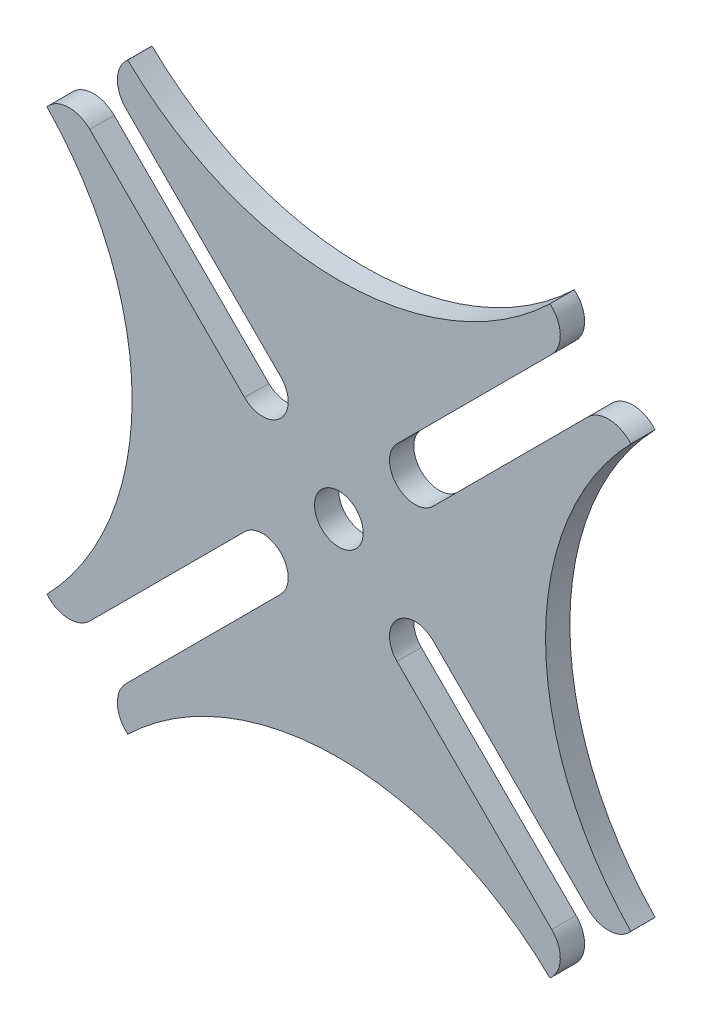
from build123d import *

# Parameters (mm, degrees)
SKICA1_R                = 5
P_IDAT_VYSUNUT_M1_DEPTH = 5


with BuildPart() as part:
    # Skica1 → Přidat vysunutím1 (new body)
    with BuildSketch(Plane.XY):
        with BuildLine():
            Line((11.954171039, 19.378792599), (43.773975828, 51.198598116))
            ThreePointArc((43.773975828, 51.198598116), (45.525986921, 55.694516194), (43.400986545, 60.026628339))
            ThreePointArc((43.400986545, 60.026628339), (5.05e-07, 42.500001775), (-43.400985944, 60.026627326))
            ThreePointArc((-43.400985944, 60.026627326), (-45.525987252, 55.694514886), (-43.77397602, 51.198596137))
            Line((-43.77397602, 51.198596137), (-11.954170503, 19.378791347))
            ThreePointArc((-11.954170503, 19.378791347), (-11.954171755, 11.954171481), (-19.378791621, 11.95417006))
            Line((-19.378791621, 11.95417006), (-51.198597038, 43.77397475))
            ThreePointArc((-51.198597038, 43.77397475), (-55.694514292, 45.525985877), (-60.026626197, 43.400986726))
            ThreePointArc((-60.026626197, 43.400986726), (-42.5, -1.49e-07), (-60.026626405, -43.400986941))
            ThreePointArc((-60.026626405, -43.400986941), (-55.694514208, -45.525987235), (-51.198596158, -43.773976041))
            Line((-51.198596158, -43.773976041), (-19.378791368, -11.954170524))
            ThreePointArc((-19.378791368, -11.954170524), (-11.954170343, -11.954171064), (-11.954170848, -19.378792089))
            Line((-11.954170848, -19.378792089), (-43.773975638, -51.198597606))
            ThreePointArc((-43.773975638, -51.198597606), (-45.52598669, -55.694515634), (-43.400986372, -60.026627739))
            ThreePointArc((-43.400986372, -60.026627739), (-7.5e-08, -42.500001775), (43.400986138, -60.026627946))
            ThreePointArc((43.400986138, -60.026627946), (45.525987031, -55.694515759), (43.773976041, -51.198597357))
            Line((43.773976041, -51.198597357), (11.954170524, -19.378792567))
            ThreePointArc((11.954170524, -19.378792567), (11.954170439, -11.954170166), (19.378792841, -11.954170081))
            Line((19.378792841, -11.954170081), (51.198597688, -43.773974201))
            ThreePointArc((51.198597688, -43.773974201), (55.694514488, -45.525985242), (60.026626197, -43.400986726))
            ThreePointArc((60.026626197, -43.400986726), (42.5, 8.27e-07), (60.026627347, 43.400987917))
            ThreePointArc((60.026627347, 43.400987917), (55.694515153, 45.525988194), (51.198597116, 43.773976998))
            Line((51.198597116, 43.773976998), (19.378792326, 11.954171481))
            ThreePointArc((19.378792326, 11.954171481), (11.954171123, 11.954171397), (11.954171039, 19.378792599))
        make_face()
        Circle(SKICA1_R, mode=Mode.SUBTRACT)
    extrude(amount=P_IDAT_VYSUNUT_M1_DEPTH)


solid = part.part
